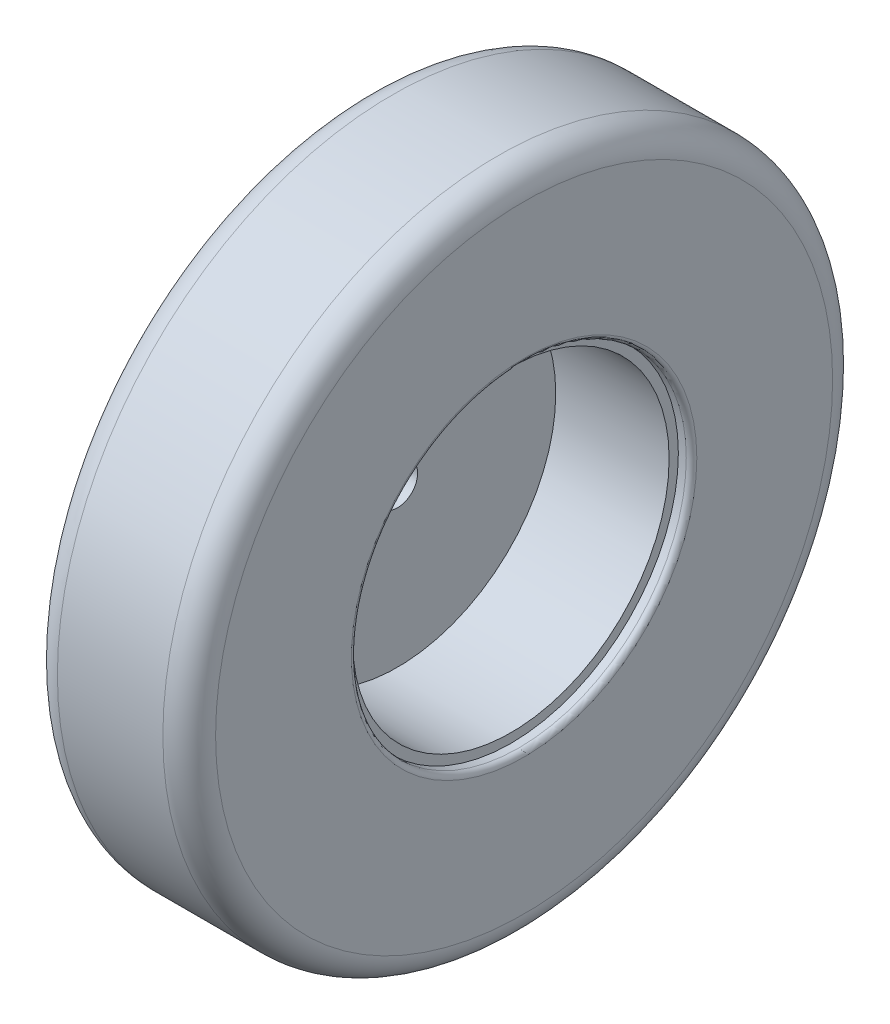
from build123d import *

# Parameters (mm, degrees)
HUB_START      = 5
SKETCH1_R      = 63.5
SKETCH1_R_2    = 7.625
HUB_FACE_DEPTH = 7
SKETCH2_R      = 63.5
SKETCH2_R_2    = 60
HUB_DEPTH      = 50
SKETCH3_R      = 127
SKETCH3_R_2    = 63.5
RUBBER_DEPTH   = 60
FILLET1_R      = 10
FILLET2_R      = 2


with BuildPart() as part:
    # Sketch1 → Hub Face (new body)
    with BuildSketch(Plane(origin=(0, 0, 0), x_dir=(0, 0, -1), z_dir=(1, 0, 0)).offset(HUB_START)):
        Circle(SKETCH1_R)
        Circle(SKETCH1_R_2, mode=Mode.SUBTRACT)
    extrude(amount=HUB_FACE_DEPTH)

    # Sketch2 → Hub (add)
    with BuildSketch(Plane(origin=(0, 0, 0), x_dir=(0, 0, -1), z_dir=(1, 0, 0)).offset(HUB_START)):
        Circle(SKETCH2_R)
        Circle(SKETCH2_R_2, mode=Mode.SUBTRACT)
    extrude(amount=HUB_DEPTH)

    # Sketch3 → Rubber (add)
    with BuildSketch(Plane(origin=(0, 0, 0), x_dir=(0, 0, -1), z_dir=(1, 0, 0))):
        Circle(SKETCH3_R)
        Circle(SKETCH3_R_2, mode=Mode.SUBTRACT)
    extrude(amount=RUBBER_DEPTH)

    # Fillet1
    fillet1_edges = [part.edges().sort_by_distance(p)[0] for p in [
        (60, 0, 127),
        (0, 0, 127),
    ]]
    fillet(fillet1_edges, radius=FILLET1_R)

    # Fillet2
    fillet2_edges = [part.edges().sort_by_distance(p)[0] for p in [
        (0, 0, 63.5),
        (60, 0, 63.5),
    ]]
    fillet(fillet2_edges, radius=FILLET2_R)


solid = part.part
